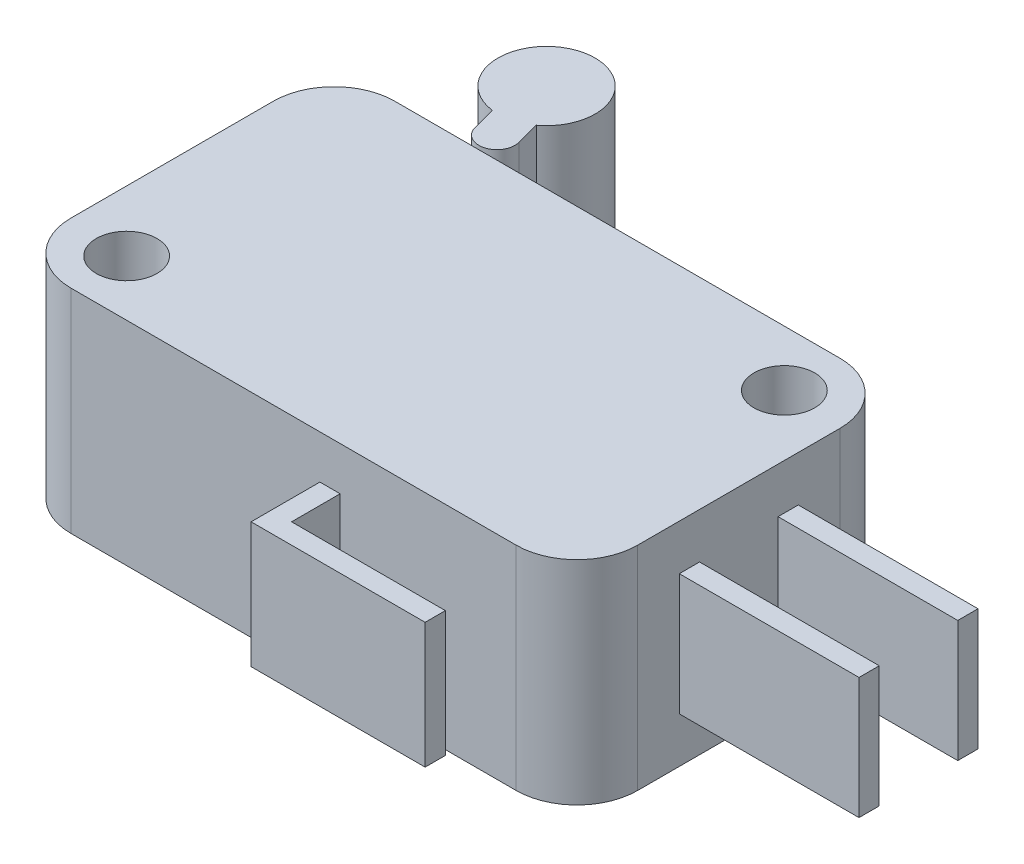
from build123d import *

# Parameters (mm, degrees)
SKETCH_1_W          = 28
SKETCH_1_H          = 16
EXTRUDE_1_DEPTH     = 5.25
FILLET_1_R          = 3
CUT_EXTRUDE_1_REACH = 21.242
SKETCH_2_R          = 1.5
SKETCH_3_W          = 8.6
SKETCH_3_H          = 6.2
EXTRUDE_2_DEPTH     = 3.4
CUT_EXTRUDE_2_REACH = 21.892
SKETCH_4_W          = 7.6
SKETCH_4_H          = 2.4
SKETCH_5_W          = 8.88
SKETCH_5_H          = 1
EXTRUDE_3_DEPTH     = 3
SKETCH_6_W          = 2.8
SKETCH_6_H          = 4.2
EXTRUDE_4_DEPTH     = 3
FILLET_2_R          = 1.2
EXTRUDE_2_2_DEPTH   = 1.5
SKETCH_7_3_R        = 2.4
EXTRUDE_5_DEPTH     = 3.55
EXTRUDE_6_DEPTH     = 3.55


with BuildPart() as part:
    # 草图1 → 凸台-拉伸1 (new, symmetric)
    with BuildSketch(Plane(origin=(0, 0, 0), x_dir=(1, 0, 0), z_dir=(0, 1, 0))):
        Rectangle(SKETCH_1_W, SKETCH_1_H)
    extrude(amount=EXTRUDE_1_DEPTH, both=True)

    # 圆角1
    fillet_1_edges = [part.edges().sort_by_distance(p)[0] for p in [
        (14, 0, 8),
        (-14, 0, -8),
        (14, 0, -8),
        (-14, 0, 8),
    ]]
    fillet(fillet_1_edges, radius=FILLET_1_R)

    # 草图2 → 切除-拉伸1 (cut, up to next)
    with BuildSketch(Plane(origin=(0, 5.25, 0), x_dir=(1, 0, 0), z_dir=(0, 1, 0)), mode=Mode.PRIVATE) as cut_extrude_1_sk1:
        with Locations((11, 5.25)):
            Circle(SKETCH_2_R)
    cut_extrude_1_tool1 = extrude(cut_extrude_1_sk1.sketch, amount=-CUT_EXTRUDE_1_REACH, mode=Mode.PRIVATE) & part.part
    # 草图2 → 切除-拉伸1 (cut, up to next)
    with BuildSketch(Plane(origin=(0, 5.25, 0), x_dir=(1, 0, 0), z_dir=(0, 1, 0)), mode=Mode.PRIVATE) as cut_extrude_1_sk2:
        with Locations((-11, -5.25)):
            Circle(SKETCH_2_R)
    cut_extrude_1_tool2 = extrude(cut_extrude_1_sk2.sketch, amount=-CUT_EXTRUDE_1_REACH, mode=Mode.PRIVATE) & part.part
    add(cut_extrude_1_tool1.solids().sort_by_distance((11, 5.25, -5.25))[0], mode=Mode.SUBTRACT)
    add(cut_extrude_1_tool2.solids().sort_by_distance((-11, 5.25, 5.25))[0], mode=Mode.SUBTRACT)

    # 草图3 → Extrude 2 (add)
    with BuildSketch(Plane.XY.offset(8)):
        with Locations((5.6, 0)):
            Rectangle(SKETCH_3_W, SKETCH_3_H)
    extrude(amount=EXTRUDE_2_DEPTH)

    # 草图4 → 切除-拉伸2 (cut, up to next)
    with BuildSketch(Plane(origin=(0, 3.1, 0), x_dir=(1, 0, 0), z_dir=(0, 1, 0)), mode=Mode.PRIVATE) as cut_extrude_2_sk1:
        with Locations((6.1, -9.2)):
            Rectangle(SKETCH_4_W, SKETCH_4_H)
    cut_extrude_2_tool1 = extrude(cut_extrude_2_sk1.sketch, amount=-CUT_EXTRUDE_2_REACH, mode=Mode.PRIVATE) & part.part
    add(cut_extrude_2_tool1.solids().sort_by_distance((6.1, 3.1, 9.2))[0], mode=Mode.SUBTRACT)

    # 草图5 → 凸台-拉伸3 (add, symmetric)
    with BuildSketch(Plane(origin=(0, 0, 0), x_dir=(1, 0, 0), z_dir=(0, 1, 0))):
        with Locations((18.44, 2.44)):
            Rectangle(SKETCH_5_W, SKETCH_5_H)
        with Locations((18.44, -2.44)):
            Rectangle(SKETCH_5_W, SKETCH_5_H)
    extrude(amount=EXTRUDE_3_DEPTH, both=True)

    # 草图6 → 凸台-拉伸4 (add)
    with BuildSketch(Plane(origin=(0, 0, -8), x_dir=(-1, 0, 0), z_dir=(0, 0, -1))):
        with Locations((9.9, 0)):
            Rectangle(SKETCH_6_W, SKETCH_6_H)
    extrude(amount=EXTRUDE_4_DEPTH)

    # 圆角2
    fillet_2_edges = [part.edges().sort_by_distance(p)[0] for p in [
        (-11.3, 0, -11),
        (-8.5, 0, -11),
    ]]
    fillet(fillet_2_edges, radius=FILLET_2_R)

    # 草图7 → Extrude 2 2 (add, symmetric)
    with BuildSketch(Plane(origin=(0, 0, 0), x_dir=(1, 0, 0), z_dir=(0, 1, 0))):
        Polygon((3.1, 8), (3.1, 9.617031783), (-9.450182098, 11.481544235), (-9.597133805, 10.492400568), (2.1, 8.754620871), (2.1, 8), align=None)
    extrude(amount=EXTRUDE_2_2_DEPTH, both=True)



with BuildPart() as body_2:
    # 草图7<3> → 凸台-拉伸5 (new, symmetric)
    with BuildSketch(Plane(origin=(0, 0, 0), x_dir=(1, 0, 0), z_dir=(0, 1, 0))):
        with Locations((-9.6, 14.1)):
            Circle(SKETCH_7_3_R)
    extrude(amount=EXTRUDE_5_DEPTH, both=True)


with BuildPart() as part_1:
    add(part.part)

    add(body_2.part)  # 凸台-拉伸6 merges body 2
    # 草图8 → 凸台-拉伸6 (add, symmetric)
    with BuildSketch(Plane(origin=(0, 0, 0), x_dir=(1, 0, 0), z_dir=(0, 1, 0))):
        with BuildLine():
            Line((-8.741039597, 14.325013226), (-7.870397769, 11.001444789))
            ThreePointArc((-7.870397769, 11.001444789), (-8.504344946, 9.917471161), (-9.588318574, 10.551418337))
            Line((-9.588318574, 10.551418337), (-10.458960403, 13.874986774))
            ThreePointArc((-10.458960403, 13.874986774), (-9.825013226, 14.958960403), (-8.741039597, 14.325013226))
        make_face()
    extrude(amount=EXTRUDE_6_DEPTH, both=True)


solid = part_1.part
